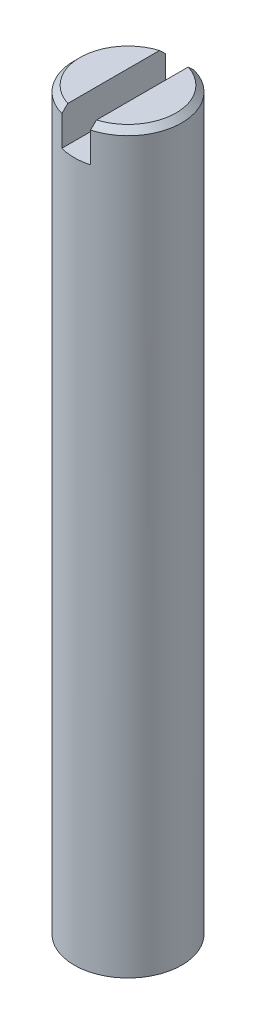
from build123d import *

# Parameters (mm, degrees)
SKETCH1_R           = 0.1875
BOSS_EXTRUDE1_DEPTH = 2.563
SKETCH2_W           = 0.1
SKETCH2_H           = 0.493436948
CUT_EXTRUDE1_DEPTH  = 0.125
CHAMFER1_SIZE       = 0.02


with BuildPart() as part:
    # Sketch1 → Boss-Extrude1 (new body)
    with BuildSketch(Plane(origin=(0, 0, 0), x_dir=(1, 0, 0), z_dir=(0, 1, 0))):
        with Locations(Location((0, 0, 0), (0, 0, 270))):
            Circle(SKETCH1_R)
    extrude(amount=BOSS_EXTRUDE1_DEPTH)

    # Sketch2 → Cut-Extrude1 (cut)
    with BuildSketch(Plane(origin=(0, 2.563, 0), x_dir=(1, 0, 0), z_dir=(0, 1, 0))):
        Rectangle(SKETCH2_W, SKETCH2_H)
    extrude(amount=-CUT_EXTRUDE1_DEPTH, mode=Mode.SUBTRACT)

    # Chamfer1
    chamfer1_edges = [part.edges().sort_by_distance(p)[0] for p in [
        (0.1875, 2.563, 0),
        (-0.1875, 2.563, 0),
    ]]
    chamfer(chamfer1_edges, length=CHAMFER1_SIZE)


solid = part.part
